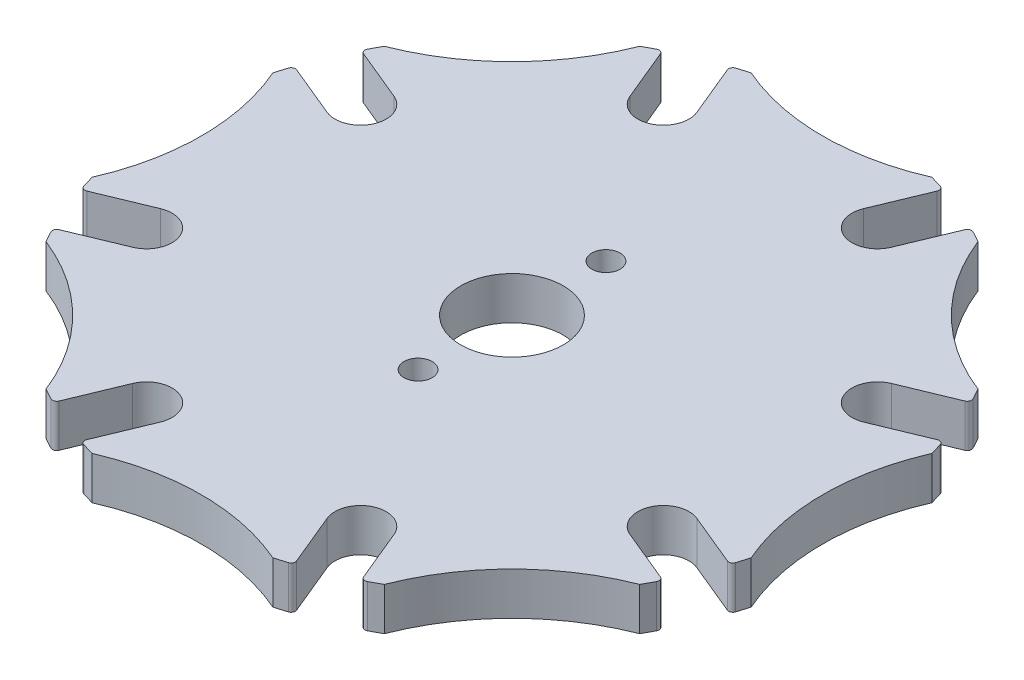
from build123d import *

# Parameters (mm, degrees)
BOSS_EXTRUDE1_DEPTH = 5
SKETCH3_R           = 1.65
SKETCH3_R_2         = 6
CUT_EXTRUDE1_DEPTH  = 10
FILLET2_R           = 0.5


with BuildPart() as part:
    # Sketch2 → Boss-Extrude1 (new body)
    with BuildSketch(Plane(origin=(0, 0, 0), x_dir=(1, 0, 0), z_dir=(0, 1, 0))):
        with BuildLine():
            ThreePointArc((31.282579036, -9.713898359), (32.385596017, -4.912508835), (32.756061614, 0))
            ThreePointArc((32.756061614, 0), (32.385596017, 4.912508835), (31.282579036, 9.713898359))
            ThreePointArc((31.282579036, 9.713898359), (27.491016293, 11.387151792), (28.988887171, 15.251360368))
            ThreePointArc((28.988887171, 15.251360368), (23.162033292, 23.162033292), (15.251360368, 28.988887171))
            ThreePointArc((15.251360368, 28.988887171), (11.387151792, 27.491016293), (9.713898359, 31.282579036))
            ThreePointArc((9.713898359, 31.282579036), (0, 32.756061614), (-9.713898359, 31.282579036))
            ThreePointArc((-9.713898359, 31.282579036), (-11.387151792, 27.491016293), (-15.251360368, 28.988887171))
            ThreePointArc((-15.251360368, 28.988887171), (-23.162033292, 23.162033292), (-28.988887171, 15.251360368))
            ThreePointArc((-28.988887171, 15.251360368), (-27.491016293, 11.387151792), (-31.282579036, 9.713898359))
            ThreePointArc((-31.282579036, 9.713898359), (-32.756061614, 0), (-31.282579036, -9.713898359))
            ThreePointArc((-31.282579036, -9.713898359), (-27.491016293, -11.387151792), (-28.988887171, -15.251360368))
            ThreePointArc((-28.988887171, -15.251360368), (-23.162033292, -23.162033292), (-15.251360368, -28.988887171))
            ThreePointArc((-15.251360368, -28.988887171), (-11.387151792, -27.491016293), (-9.713898359, -31.282579036))
            ThreePointArc((-9.713898359, -31.282579036), (0, -32.756061614), (9.713898359, -31.282579036))
            ThreePointArc((9.713898359, -31.282579036), (11.387151792, -27.491016293), (15.251360368, -28.988887171))
            ThreePointArc((15.251360368, -28.988887171), (23.162033292, -23.162033292), (28.988887171, -15.251360368))
            ThreePointArc((28.988887171, -15.251360368), (27.491016293, -11.387151792), (31.282579036, -9.713898359))
        make_face()
        with BuildLine():
            Line((9.763563492, 31.410705188), (12.492586098, 37.999148577))
            ThreePointArc((12.492586098, 37.999148577), (11.533874506, 38.301040963), (10.567880231, 38.578749428))
            ThreePointArc((10.567880231, 38.578749428), (0, 36.37003279), (-10.567880231, 38.578749428))
            ThreePointArc((-10.567880231, 38.578749428), (-11.533874506, 38.301040963), (-12.492586098, 37.999148577))
            Line((-12.492586098, 37.999148577), (-9.763563492, 31.410705188))
            ThreePointArc((-9.763563492, 31.410705188), (-9.737997226, 31.346926513), (-9.713898359, 31.282579036))
            ThreePointArc((-9.713898359, 31.282579036), (0, 32.756061614), (9.713898359, 31.282579036))
            ThreePointArc((9.713898359, 31.282579036), (9.737997226, 31.346926513), (9.763563492, 31.410705188))
        make_face()
        with BuildLine():
            ThreePointArc((-18.035863293, 35.703047983), (-18.927244915, 35.238606668), (-19.806675556, 34.751915104))
            ThreePointArc((-19.806675556, 34.751915104), (-25.717496818, 25.717496818), (-34.751915104, 19.806675556))
            ThreePointArc((-34.751915104, 19.806675556), (-35.238606668, 18.927244915), (-35.703047983, 18.035863293))
            Line((-35.703047983, 18.035863293), (-29.114604594, 15.306840687))
            ThreePointArc((-29.114604594, 15.306840687), (-29.05142818, 15.279820434), (-28.988887171, 15.251360368))
            ThreePointArc((-28.988887171, 15.251360368), (-23.162033292, 23.162033292), (-15.251360368, 28.988887171))
            ThreePointArc((-15.251360368, 28.988887171), (-15.279820434, 29.05142818), (-15.306840687, 29.114604594))
            Line((-15.306840687, 29.114604594), (-18.035863293, 35.703047983))
        make_face()
        with BuildLine():
            ThreePointArc((-37.999148577, 12.492586098), (-38.301040963, 11.533874506), (-38.578749428, 10.567880231))
            ThreePointArc((-38.578749428, 10.567880231), (-36.928113831, 5.3981136), (-36.37003279, 0))
            ThreePointArc((-36.37003279, 0), (-36.928113831, -5.3981136), (-38.578749428, -10.567880231))
            ThreePointArc((-38.578749428, -10.567880231), (-38.301040963, -11.533874506), (-37.999148577, -12.492586098))
            Line((-37.999148577, -12.492586098), (-31.410705188, -9.763563492))
            ThreePointArc((-31.410705188, -9.763563492), (-31.346926513, -9.737997226), (-31.282579036, -9.713898359))
            ThreePointArc((-31.282579036, -9.713898359), (-32.756061614, 0), (-31.282579036, 9.713898359))
            ThreePointArc((-31.282579036, 9.713898359), (-31.346926513, 9.737997226), (-31.410705188, 9.763563492))
            Line((-31.410705188, 9.763563492), (-37.999148577, 12.492586098))
        make_face()
        with BuildLine():
            ThreePointArc((-15.306840687, -29.114604594), (-15.279820434, -29.05142818), (-15.251360368, -28.988887171))
            ThreePointArc((-15.251360368, -28.988887171), (-23.162033292, -23.162033292), (-28.988887171, -15.251360368))
            ThreePointArc((-28.988887171, -15.251360368), (-29.05142818, -15.279820434), (-29.114604594, -15.306840687))
            Line((-29.114604594, -15.306840687), (-35.703047983, -18.035863293))
            ThreePointArc((-35.703047983, -18.035863293), (-35.238606668, -18.927244915), (-34.751915104, -19.806675556))
            ThreePointArc((-34.751915104, -19.806675556), (-25.717496818, -25.717496818), (-19.806675556, -34.751915104))
            ThreePointArc((-19.806675556, -34.751915104), (-18.927244915, -35.238606668), (-18.035863293, -35.703047983))
            Line((-18.035863293, -35.703047983), (-15.306840687, -29.114604594))
        make_face()
        with BuildLine():
            ThreePointArc((9.763563492, -31.410705188), (9.737997226, -31.346926513), (9.713898359, -31.282579036))
            ThreePointArc((9.713898359, -31.282579036), (0, -32.756061614), (-9.713898359, -31.282579036))
            ThreePointArc((-9.713898359, -31.282579036), (-9.737997226, -31.346926513), (-9.763563492, -31.410705188))
            Line((-9.763563492, -31.410705188), (-12.492586098, -37.999148577))
            ThreePointArc((-12.492586098, -37.999148577), (-11.533874506, -38.301040963), (-10.567880231, -38.578749428))
            ThreePointArc((-10.567880231, -38.578749428), (0, -36.37003279), (10.567880231, -38.578749428))
            ThreePointArc((10.567880231, -38.578749428), (11.533874506, -38.301040963), (12.492586098, -37.999148577))
            Line((12.492586098, -37.999148577), (9.763563492, -31.410705188))
        make_face()
        with BuildLine():
            ThreePointArc((29.114604594, -15.306840687), (29.05142818, -15.279820434), (28.988887171, -15.251360368))
            ThreePointArc((28.988887171, -15.251360368), (23.162033292, -23.162033292), (15.251360368, -28.988887171))
            ThreePointArc((15.251360368, -28.988887171), (15.279820434, -29.05142818), (15.306840687, -29.114604594))
            Line((15.306840687, -29.114604594), (18.035863293, -35.703047983))
            ThreePointArc((18.035863293, -35.703047983), (18.927244915, -35.238606668), (19.806675556, -34.751915104))
            ThreePointArc((19.806675556, -34.751915104), (25.717496818, -25.717496818), (34.751915104, -19.806675556))
            ThreePointArc((34.751915104, -19.806675556), (35.238606668, -18.927244915), (35.703047983, -18.035863293))
            Line((35.703047983, -18.035863293), (29.114604594, -15.306840687))
        make_face()
        with BuildLine():
            ThreePointArc((34.934473466, -11.223156103), (33.305699609, -5.716308055), (32.756061614, 0))
            ThreePointArc((32.756061614, 0), (32.385596017, -4.912508835), (31.282579036, -9.713898359))
            ThreePointArc((31.282579036, -9.713898359), (31.346926513, -9.737997226), (31.410705188, -9.763563492))
            Line((31.410705188, -9.763563492), (34.934473466, -11.223156103))
        make_face()
        with BuildLine():
            ThreePointArc((38.578749428, 10.567880231), (38.301040963, 11.533874506), (37.999148577, 12.492586098))
            Line((37.999148577, 12.492586098), (34.934473466, 11.223156103))
            ThreePointArc((34.934473466, 11.223156103), (33.305699609, 5.716308055), (32.756061614, 0))
            ThreePointArc((32.756061614, 0), (33.305699609, -5.716308055), (34.934473466, -11.223156103))
            Line((34.934473466, -11.223156103), (37.999148577, -12.492586098))
            ThreePointArc((37.999148577, -12.492586098), (38.301040963, -11.533874506), (38.578749428, -10.567880231))
            ThreePointArc((38.578749428, -10.567880231), (36.37003279, 0), (38.578749428, 10.567880231))
        make_face()
        with BuildLine():
            ThreePointArc((32.756061614, 0), (33.305699609, 5.716308055), (34.934473466, 11.223156103))
            Line((34.934473466, 11.223156103), (31.410705188, 9.763563492))
            ThreePointArc((31.410705188, 9.763563492), (31.346926513, 9.737997226), (31.282579036, 9.713898359))
            ThreePointArc((31.282579036, 9.713898359), (32.385596017, 4.912508835), (32.756061614, 0))
        make_face()
        with BuildLine():
            Line((29.114604594, 15.306840687), (35.703047983, 18.035863293))
            ThreePointArc((35.703047983, 18.035863293), (35.238606668, 18.927244915), (34.751915104, 19.806675556))
            ThreePointArc((34.751915104, 19.806675556), (25.717496818, 25.717496818), (19.806675556, 34.751915104))
            ThreePointArc((19.806675556, 34.751915104), (18.927244915, 35.238606668), (18.035863293, 35.703047983))
            Line((18.035863293, 35.703047983), (15.306840687, 29.114604594))
            ThreePointArc((15.306840687, 29.114604594), (15.279820434, 29.05142818), (15.251360368, 28.988887171))
            ThreePointArc((15.251360368, 28.988887171), (23.162033292, 23.162033292), (28.988887171, 15.251360368))
            ThreePointArc((28.988887171, 15.251360368), (29.05142818, 15.279820434), (29.114604594, 15.306840687))
        make_face()
    extrude(amount=BOSS_EXTRUDE1_DEPTH)

    # Sketch3 → Cut-Extrude1 (cut)
    with BuildSketch(Plane(origin=(0, 5, 0), x_dir=(1, 0, 0), z_dir=(0, 1, 0))):
        with Locations(Location((0, 11, 0), (0, 0, 270))):
            Circle(SKETCH3_R)
        with Locations(Location((0, 0, 0), (0, 0, 270))):
            Circle(SKETCH3_R_2)
        with Locations(Location((0, -11, 0), (0, 0, 270))):
            Circle(SKETCH3_R)
    extrude(amount=-CUT_EXTRUDE1_DEPTH, mode=Mode.SUBTRACT)

    # Fillet2
    fillet2_edges = [part.edges().sort_by_distance(p)[0] for p in [
        (18.035863293, 2.5, -35.703047983),
        (35.703047983, 2.5, -18.035863293),
        (37.999148577, 2.5, -12.492586098),
        (37.999148577, 2.5, 12.492586098),
        (35.703047983, 2.5, 18.035863293),
        (18.035863293, 2.5, 35.703047983),
        (12.492586098, 2.5, 37.999148577),
        (-12.492586098, 2.5, 37.999148577),
        (-18.035863293, 2.5, 35.703047983),
        (-35.703047983, 2.5, 18.035863293),
        (-37.999148577, 2.5, 12.492586098),
        (-37.999148577, 2.5, -12.492586098),
        (-35.703047983, 2.5, -18.035863293),
        (-18.035863293, 2.5, -35.703047983),
        (-12.492586098, 2.5, -37.999148577),
        (12.492586098, 2.5, -37.999148577),
    ]]
    fillet(fillet2_edges, radius=FILLET2_R)


solid = part.part
